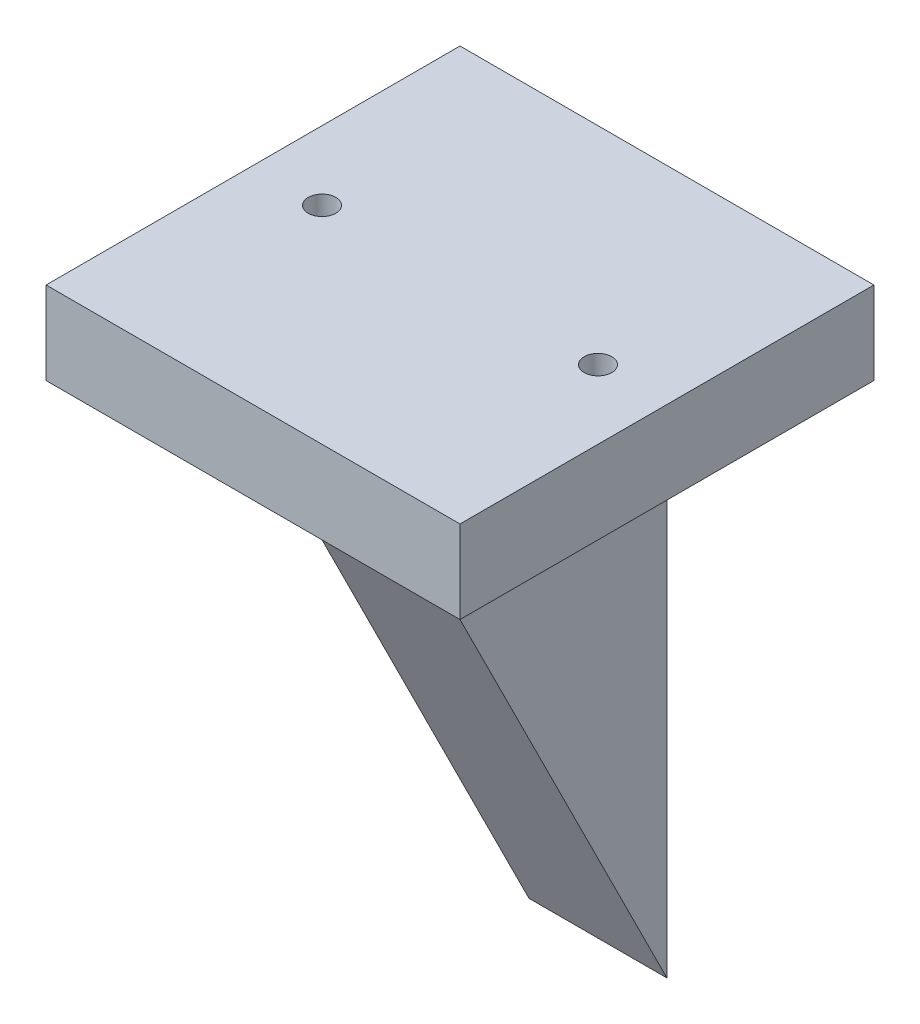
from build123d import *

# Parameters (mm, degrees)
EXTRUDE_1_DEPTH = 5
SKETCH_2_W      = 15
SKETCH_2_H      = 15
SKETCH_2_R      = 0.5
EXTRUDE_2_DEPTH = 3


with BuildPart() as part:
    # Эскиз1 → Бобышка-Вытянуть1 (new body)
    with BuildSketch(Plane(origin=(0, 0, 0), x_dir=(0, 0, -1), z_dir=(1, 0, 0))):
        Polygon((-10, 20), (0, 0), (0, 20), align=None)
    extrude(amount=EXTRUDE_1_DEPTH)

    # Эскиз2 → Бобышка-Вытянуть2 (add)
    with BuildSketch(Plane(origin=(0, 20, 0), x_dir=(1, 0, 0), z_dir=(0, 1, 0))):
        with Locations((2.5, -5)):
            Rectangle(SKETCH_2_W, SKETCH_2_H)
        with Locations(Location((-2.5, -5, 0), (0, 0, 270))):
            Circle(SKETCH_2_R, mode=Mode.SUBTRACT)
        with Locations(Location((7.5, -5, 0), (0, 0, 270))):
            Circle(SKETCH_2_R, mode=Mode.SUBTRACT)
    extrude(amount=EXTRUDE_2_DEPTH)


solid = part.part
